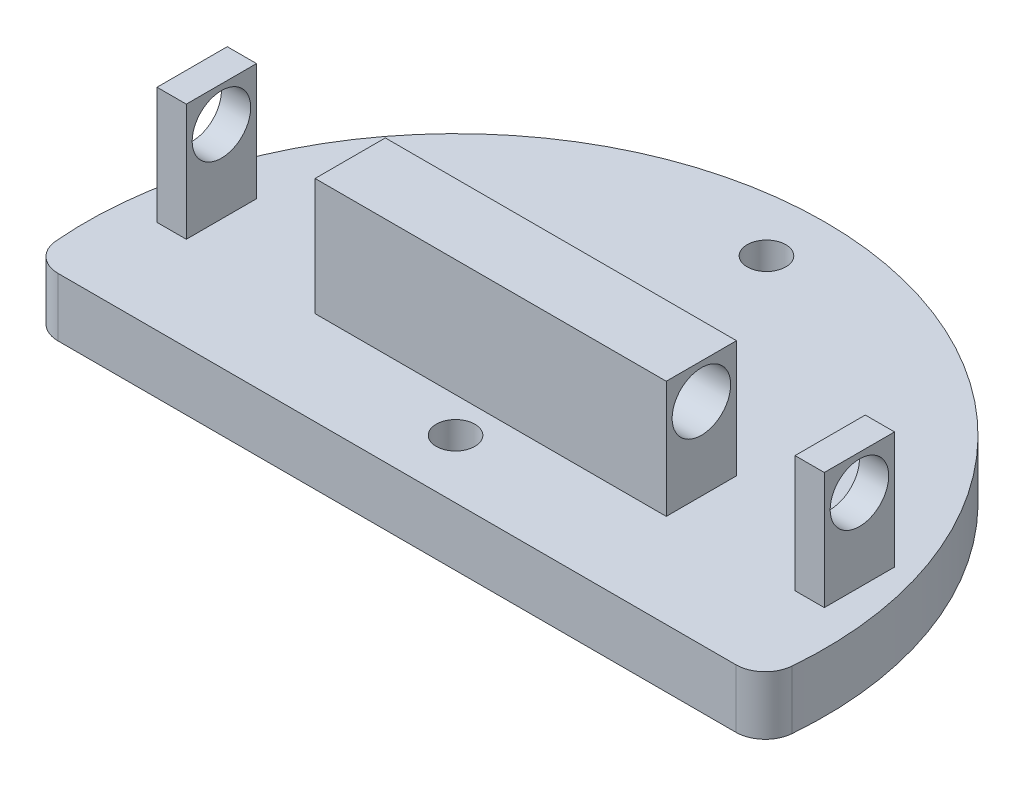
from build123d import *

# Parameters (mm, degrees)
SKETCH1_R           = 1.65
BOSS_EXTRUDE1_DEPTH = 5
FILLET1_R           = 2.5
SKETCH2_W           = 2.5
SKETCH2_H           = 6
SKETCH2_W_2         = 30
BOSS_EXTRUDE2_DEPTH = 10
SKETCH3_R           = 2.5
CUT_EXTRUDE1_DEPTH  = 70.485517916


with BuildPart() as part:
    # Sketch1 → Boss-Extrude1 (new body)
    with BuildSketch(Plane(origin=(0, 0, 0), x_dir=(1, 0, 0), z_dir=(0, 1, 0))):
        with BuildLine():
            Line((0, -5), (-31.161412035, -5))
            ThreePointArc((-31.161412035, -5), (0, 31.56), (31.161412035, -5))
            Line((31.161412035, -5), (0, -5))
        make_face()
        with Locations(Location((0, 0, 0), (0, 0, 270))):
            Circle(SKETCH1_R, mode=Mode.SUBTRACT)
        with Locations(Location((0, 26.56, 0), (0, 0, 270))):
            Circle(SKETCH1_R, mode=Mode.SUBTRACT)
    extrude(amount=BOSS_EXTRUDE1_DEPTH)

    # Fillet1
    fillet1_edges = [part.edges().sort_by_distance(p)[0] for p in [
        (31.161412035, 2.5, 5),
        (-31.161412035, 2.5, 5),
    ]]
    fillet(fillet1_edges, radius=FILLET1_R)

    # Sketch2 → Boss-Extrude2 (add)
    with BuildSketch(Plane(origin=(0, 5, 0), x_dir=(1, 0, 0), z_dir=(0, 1, 0))):
        with Locations((-27.25, 6)):
            Rectangle(SKETCH2_W, SKETCH2_H)
        with Locations((27.25, 6)):
            Rectangle(SKETCH2_W, SKETCH2_H)
        with Locations((0, 6)):
            Rectangle(SKETCH2_W_2, SKETCH2_H)
    extrude(amount=BOSS_EXTRUDE2_DEPTH)

    # Sketch3 → Cut-Extrude1 (cut, through all)
    with BuildSketch(Plane.ZY.offset(28.5)):
        with Locations((-6, 12)):
            Circle(SKETCH3_R)
    extrude(amount=-CUT_EXTRUDE1_DEPTH, mode=Mode.SUBTRACT)


solid = part.part
